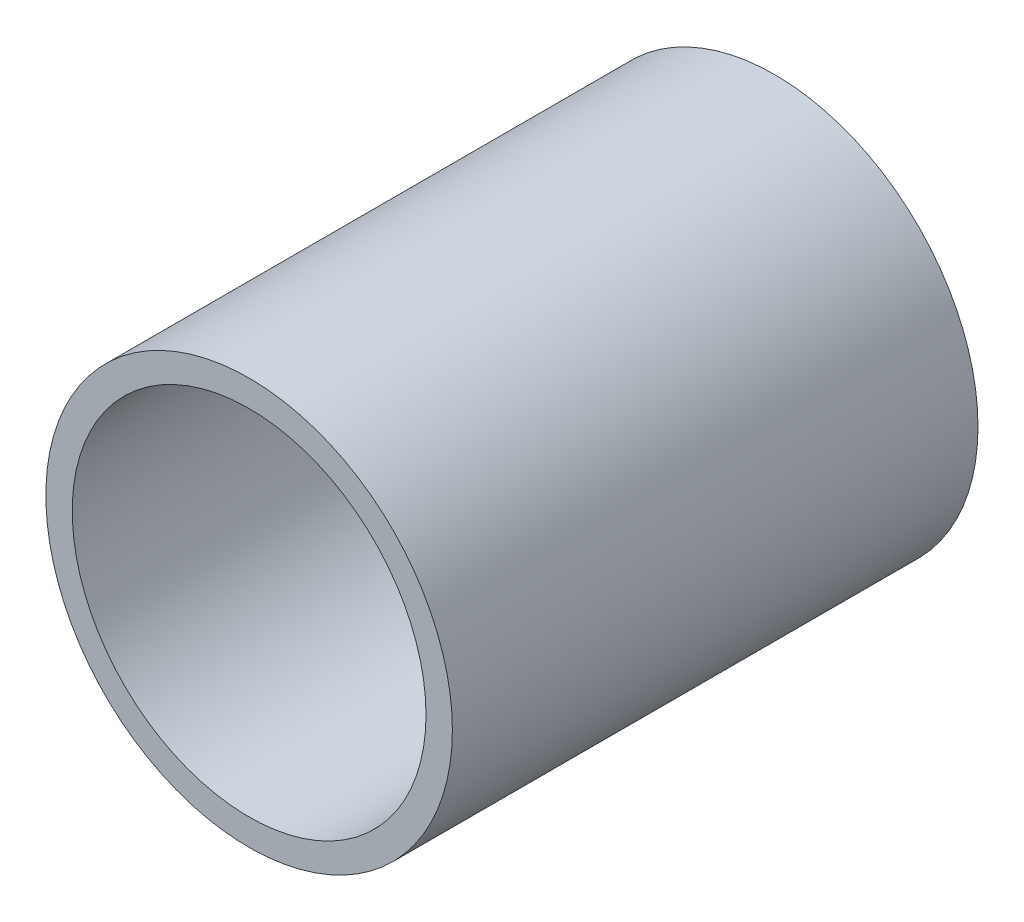
from build123d import *

# Parameters (mm, degrees)
SKETCH1_R           = 30.1625
SKETCH1_R_2         = 26.2509
EXTRUDE_THIN1_DEPTH = 39


with BuildPart() as part:
    # Sketch1 → Extrude-Thin1 (new, symmetric)
    with BuildSketch(Plane.XY):
        Circle(SKETCH1_R)
        Circle(SKETCH1_R_2, mode=Mode.SUBTRACT)
    extrude(amount=EXTRUDE_THIN1_DEPTH, both=True)


solid = part.part
